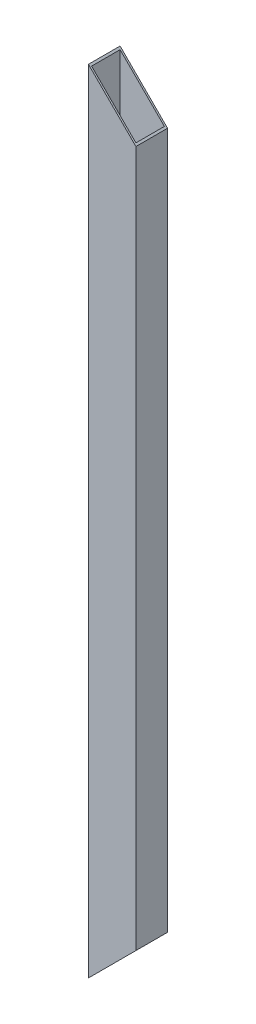
from build123d import *

# Parameters (mm, degrees)
IZIM1_W                     = 60
IZIM1_H                     = 40
IZIM1_W_2                   = 56
IZIM1_H_2                   = 36
Y_KSEKLIK_EKSTR_ZYON1_DEPTH = 1000
KES_EKSTR_ZYON1_DEPTH       = 700


with BuildPart() as part:
    # Çizim1 → Yükseklik-Ekstrüzyon1 (new body)
    with BuildSketch(Plane(origin=(0, 0, 0), x_dir=(1, 0, 0), z_dir=(0, 1, 0))):
        with Locations((30, 20)):
            Rectangle(IZIM1_W, IZIM1_H)
        with Locations((30, 20)):
            Rectangle(IZIM1_W_2, IZIM1_H_2, mode=Mode.SUBTRACT)
    extrude(amount=Y_KSEKLIK_EKSTR_ZYON1_DEPTH)

    # Çizim2 → Kes-Ekstrüzyon1 (cut)
    with BuildSketch(Plane(origin=(0, 0, -40), x_dir=(-1, 0, 0), z_dir=(0, 0, -1))):
        Polygon((-60, 940), (0, 1000), (-60, 1000), align=None)
        Polygon((-60, 0), (0, 0), (-60, 60), align=None)
    extrude(amount=-KES_EKSTR_ZYON1_DEPTH, mode=Mode.SUBTRACT)


solid = part.part
